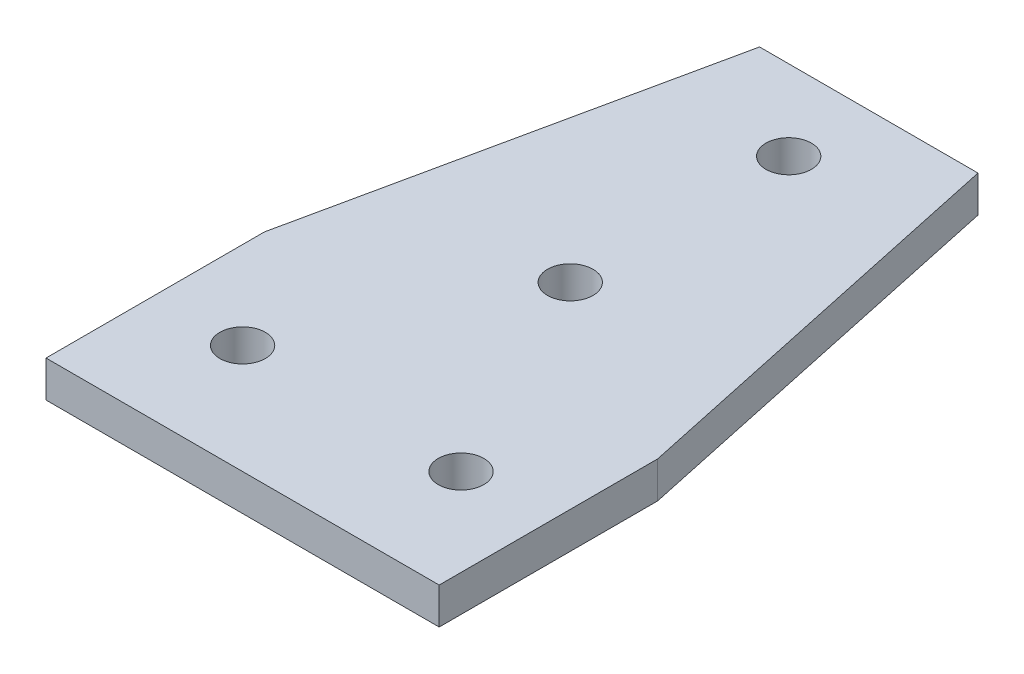
from build123d import *

# Parameters (mm, degrees)
SKETCH1_R           = 3.96875
BOSS_EXTRUDE1_DEPTH = 6.35


with BuildPart() as part:
    # Sketch1 → Boss-Extrude1 (new body)
    with BuildSketch(Plane(origin=(0, 0, 0), x_dir=(1, 0, 0), z_dir=(0, 1, 0))):
        Polygon((-34.29, 19.05), (-34.29, -19.05), (34.29, -19.05), (34.29, 19.05), (19.05, 90.17), (-19.05, 90.17), align=None)
        with Locations(Location((-19.05, 0, 0), (0, 0, 270))):
            Circle(SKETCH1_R, mode=Mode.SUBTRACT)
        with Locations(Location((19.05, 0, 0), (0, 0, 270))):
            Circle(SKETCH1_R, mode=Mode.SUBTRACT)
        with Locations(Location((0, 76.2, 0), (0, 0, 270))):
            Circle(SKETCH1_R, mode=Mode.SUBTRACT)
        with Locations(Location((0, 38.1, 0), (0, 0, 270))):
            Circle(SKETCH1_R, mode=Mode.SUBTRACT)
    extrude(amount=BOSS_EXTRUDE1_DEPTH)


solid = part.part
